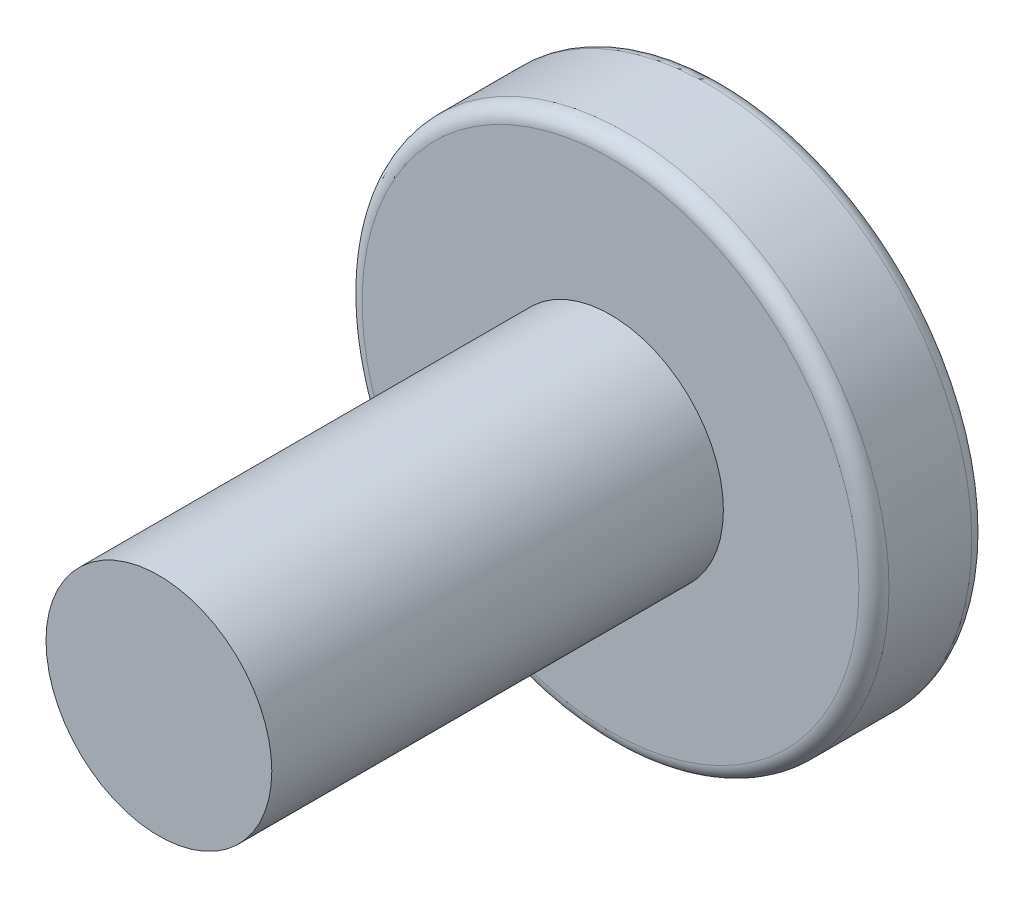
from build123d import *

# Parameters (mm, degrees)
SKETCH_1_R          = 3.5
EXTRUDE_1_DEPTH     = 1.5
SKETCH_2_R          = 1.5
EXTRUDE_2_DEPTH     = 6
FILLET_1_R          = 0.2
CUT_EXTRUDE_1_DEPTH = 1.5


with BuildPart() as part:
    # 草图1 → 凸台-拉伸1 (new body)
    with BuildSketch(Plane.XY):
        Circle(SKETCH_1_R)
    extrude(amount=EXTRUDE_1_DEPTH)

    # 草图2 → 凸台-拉伸2 (add)
    with BuildSketch(Plane.XY.offset(1.5)):
        Circle(SKETCH_2_R)
    extrude(amount=EXTRUDE_2_DEPTH)

    # 圆角1
    fillet_1_edges = [part.edges().sort_by_distance(p)[0] for p in [
        (-3.5, 0, 0),
        (-3.5, 0, 1.5),
    ]]
    fillet(fillet_1_edges, radius=FILLET_1_R)

    # 草图3 → 切除-拉伸1 (cut)
    with BuildSketch(Plane(origin=(0, 0, 0), x_dir=(-1, 0, 0), z_dir=(0, 0, -1))):
        Polygon((1.154700538, 0), (0.577350269, 1), (-0.577350269, 1), (-1.154700538, 0), (-0.577350269, -1), (0.577350269, -1), align=None)
    extrude(amount=-CUT_EXTRUDE_1_DEPTH, mode=Mode.SUBTRACT)


solid = part.part
